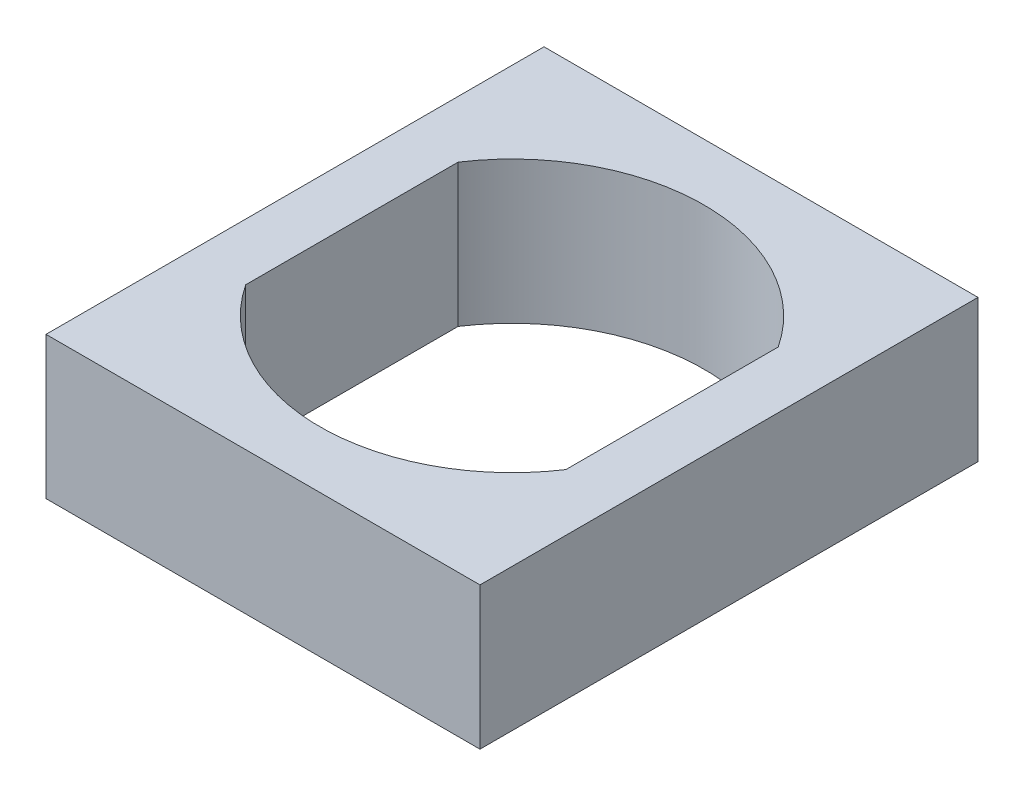
from build123d import *

# Parameters (mm, degrees)
SKETCH1_W           = 6.1
SKETCH1_H           = 7
BOSS_EXTRUDE1_DEPTH = 2


with BuildPart() as part:
    # Sketch1 → Boss-Extrude1 (new body)
    with BuildSketch(Plane(origin=(0, 45.508917933, 0), x_dir=(1, 0, 0), z_dir=(0, 1, 0))):
        with Locations((30.616567665, -69.125832733)):
            Rectangle(SKETCH1_W, SKETCH1_H)
        with BuildLine():
            Line((32.866567665, -67.633351578), (32.866567665, -70.618313889))
            ThreePointArc((32.866567665, -70.618313889), (30.616567665, -71.825832733), (28.366567665, -70.618313889))
            Line((28.366567665, -70.618313889), (28.366567665, -67.633351578))
            ThreePointArc((28.366567665, -67.633351578), (30.616567665, -66.425832733), (32.866567665, -67.633351578))
        make_face(mode=Mode.SUBTRACT)
    extrude(amount=BOSS_EXTRUDE1_DEPTH)


solid = part.part
